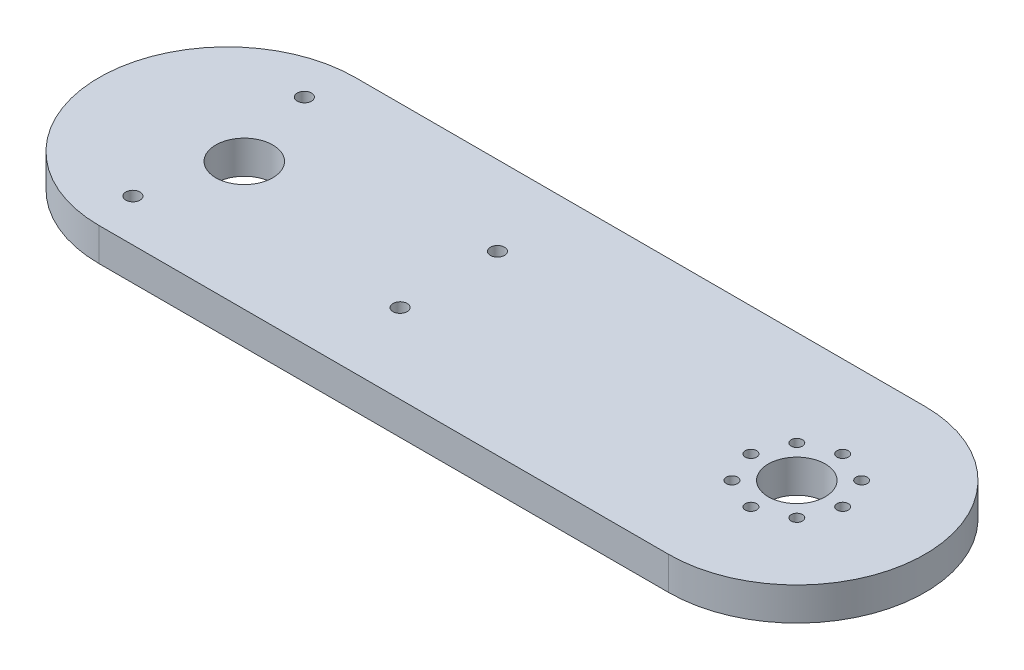
from build123d import *

# Parameters (mm, degrees)
BOSS_EXTRUDE1_DEPTH     = 2.9
CUT_EXTRUDE1_DEPTH      = 77.132384699
CUT_EXTRUDE1_DEPTH_BACK = 77.132384699
SKETCH3_R               = 0.99
SKETCH4_R               = 5
CUT_EXTRUDE2_DEPTH      = 77.132384699
CUT_EXTRUDE3_DEPTH      = 77.132384699
CUT_EXTRUDE3_DEPTH_BACK = 77.132384699
SKETCH5_R               = 1.25
SKETCH5_R_2             = 5


with BuildPart() as part:
    # Sketch2 → Boss-Extrude1 (new, symmetric)
    with BuildSketch(Plane(origin=(0, 0, 0), x_dir=(1, 0, 0), z_dir=(0, 1, 0))):
        with BuildLine():
            Line((50, -22.5), (-50, -22.5))
            ThreePointArc((-50, -22.5), (-72.5, 0), (-50, 22.5))
            Line((-50, 22.5), (50, 22.5))
            ThreePointArc((50, 22.5), (72.5, 0), (50, -22.5))
        make_face()
    extrude(amount=BOSS_EXTRUDE1_DEPTH, both=True)

    # Sketch3 → Cut-Extrude1 (cut, two sides: drawn at the far end of the back side and taken through both)
    with BuildSketch(Plane(origin=(0, 2.9, 0), x_dir=(1, 0, 0), z_dir=(0, 1, 0)).offset(-CUT_EXTRUDE1_DEPTH_BACK)):
        with Locations(Location((41.95, 0, 0), (0, 0, 270))):
            Circle(SKETCH3_R)
        with Locations(Location((44.307790411, 5.692209589, 0), (0, 0, 270))):
            Circle(SKETCH3_R)
        with Locations(Location((50, 8.05, 0), (0, 0, 270))):
            Circle(SKETCH3_R)
        with Locations(Location((55.692209589, 5.692209589, 0), (0, 0, 270))):
            Circle(SKETCH3_R)
        with Locations(Location((58.05, 0, 0), (0, 0, 270))):
            Circle(SKETCH3_R)
        with Locations(Location((55.692209589, -5.692209589, 0), (0, 0, 270))):
            Circle(SKETCH3_R)
        with Locations(Location((50, -8.05, 0), (0, 0, 270))):
            Circle(SKETCH3_R)
        with Locations(Location((44.307790411, -5.692209589, 0), (0, 0, 270))):
            Circle(SKETCH3_R)
    extrude(amount=CUT_EXTRUDE1_DEPTH + CUT_EXTRUDE1_DEPTH_BACK, mode=Mode.SUBTRACT)

    # Sketch4 → Cut-Extrude2 (cut, through all)
    with BuildSketch(Plane(origin=(0, 2.9, 0), x_dir=(1, 0, 0), z_dir=(0, 1, 0))):
        with Locations(Location((50, 0, 0), (0, 0, 270))):
            Circle(SKETCH4_R)
    extrude(amount=-CUT_EXTRUDE2_DEPTH, mode=Mode.SUBTRACT)

    # Sketch5 → Cut-Extrude3 (cut, two sides: drawn at the far end of the back side and taken through both)
    with BuildSketch(Plane(origin=(0, 2.9, 0), x_dir=(1, 0, 0), z_dir=(0, 1, 0)).offset(-CUT_EXTRUDE3_DEPTH_BACK)):
        with Locations(Location((-51.5, -15.05, 0), (0, 0, 270))):
            Circle(SKETCH5_R)
        with Locations(Location((-51.5, 15.05, 0), (0, 0, 270))):
            Circle(SKETCH5_R)
        with Locations(Location((-11.1, 8.55, 0), (0, 0, 270))):
            Circle(SKETCH5_R)
        with Locations(Location((-11.1, -8.55, 0), (0, 0, 270))):
            Circle(SKETCH5_R)
        with Locations(Location((-47, 0, 0), (0, 0, 270))):
            Circle(SKETCH5_R_2)
    extrude(amount=CUT_EXTRUDE3_DEPTH + CUT_EXTRUDE3_DEPTH_BACK, mode=Mode.SUBTRACT)


solid = part.part
